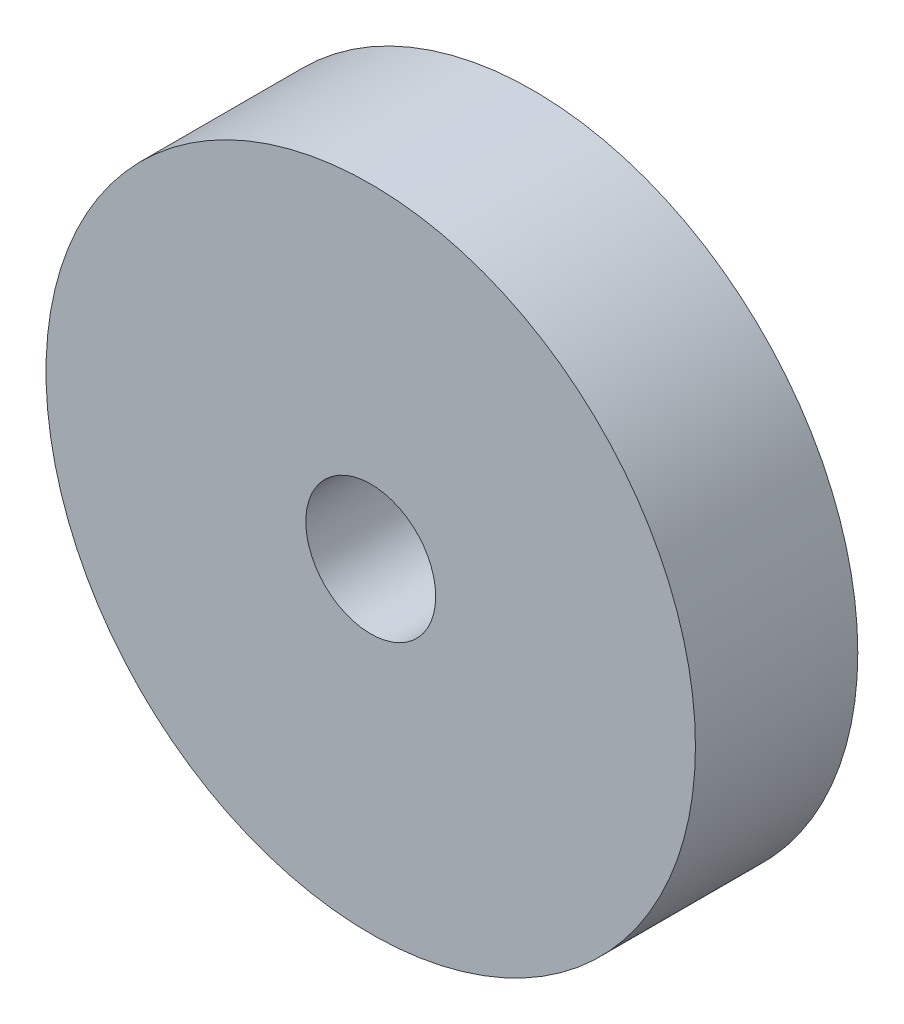
from build123d import *

# Parameters (mm, degrees)
SKETCH_1_R      = 5
SKETCH_1_R_2    = 1
EXTRUDE_1_DEPTH = 2.5


with BuildPart() as part:
    # ｽｹｯﾁ1 → ﾎﾞｽ - 押し出し1 (new body)
    with BuildSketch(Plane.XY):
        Circle(SKETCH_1_R)
        Circle(SKETCH_1_R_2, mode=Mode.SUBTRACT)
    extrude(amount=EXTRUDE_1_DEPTH)


solid = part.part
